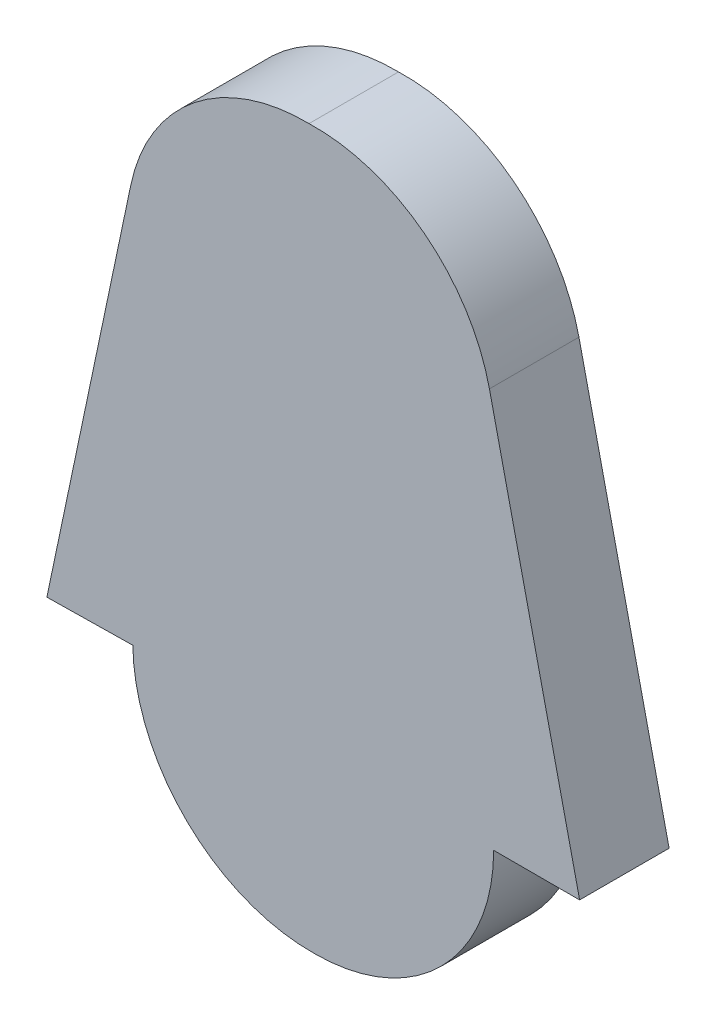
from build123d import *

# Parameters (mm, degrees)
BOSS_EXTRUDE1_DEPTH = 1.5875


with BuildPart() as part:
    # Sketch2 → Boss-Extrude1 (new, symmetric)
    with BuildSketch(Plane.XY):
        with BuildLine():
            Line((55.130521201, -12.193939448), (51.93209544, 1.905344025))
            ThreePointArc((51.93209544, 1.905344025), (49.621085039, 5.5280528), (45.533364229, 6.85294016))
            ThreePointArc((45.533364229, 6.85294016), (41.466923822, 5.464109588), (39.213011171, 1.80560365))
            Line((39.213011171, 1.80560365), (36.236092368, -12.342105573))
            Line((36.236092368, -12.342105573), (39.283717526, -12.294304966))
            ThreePointArc((39.283717526, -12.294304966), (41.213777682, -16.754713179), (45.732521201, -18.543939448))
            ThreePointArc((45.732521201, -18.543939448), (50.222649262, -16.684067509), (52.082521201, -12.193939448))
            Line((52.082521201, -12.193939448), (55.130521201, -12.193939448))
        make_face()
    extrude(amount=BOSS_EXTRUDE1_DEPTH, both=True)


solid = part.part
